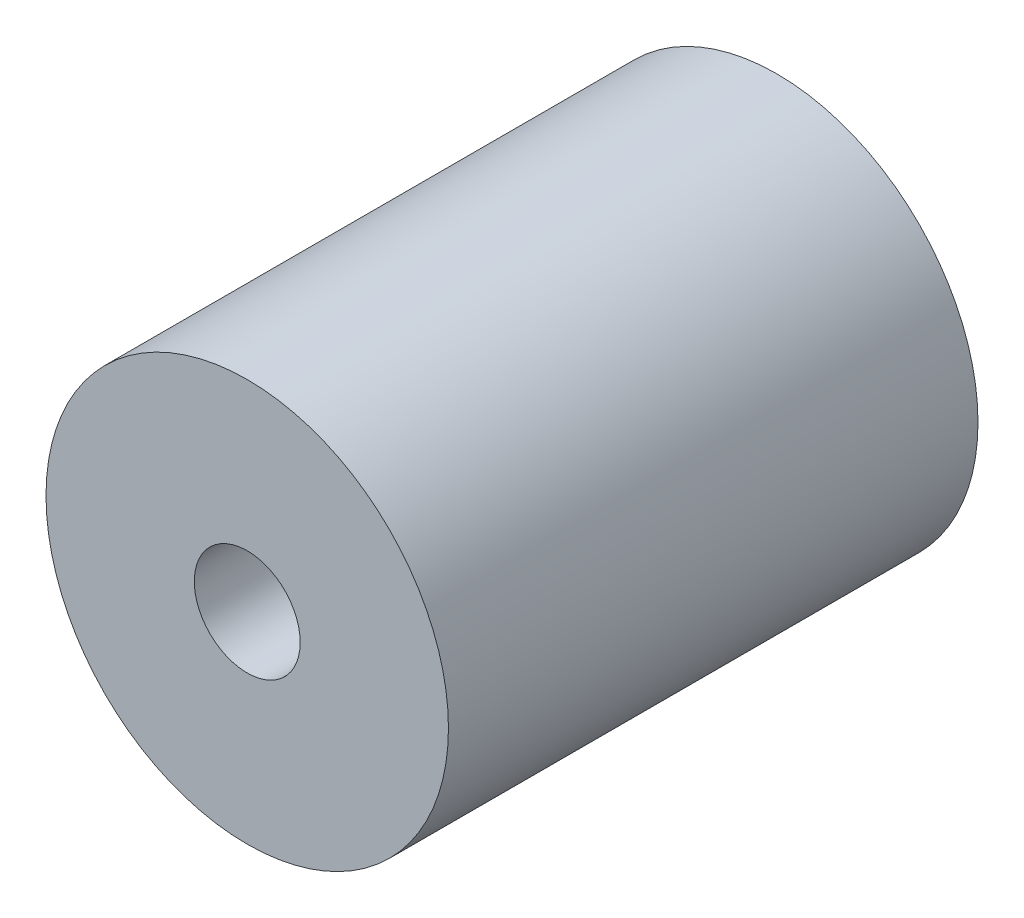
from build123d import *

# Parameters (mm, degrees)
SKETCH_1_R          = 9.5
EXTRUDE_1_DEPTH     = 25
SKETCH_2_R          = 4
CUT_EXTRUDE_1_DEPTH = 17.5
SKETCH_3_R          = 2.5
CUT_EXTRUDE_2_DEPTH = 7.5


with BuildPart() as part:
    # 草图1 → 凸台-拉伸1 (new body)
    with BuildSketch(Plane.XY):
        Circle(SKETCH_1_R)
    extrude(amount=EXTRUDE_1_DEPTH)

    # 草图2 → 切除-拉伸1 (cut)
    with BuildSketch(Plane(origin=(0, 0, 0), x_dir=(-1, 0, 0), z_dir=(0, 0, -1))):
        Circle(SKETCH_2_R)
    extrude(amount=-CUT_EXTRUDE_1_DEPTH, mode=Mode.SUBTRACT)

    # 草图3 → 切除-拉伸2 (cut)
    with BuildSketch(Plane.XY.offset(25)):
        Circle(SKETCH_3_R)
    extrude(amount=-CUT_EXTRUDE_2_DEPTH, mode=Mode.SUBTRACT)


solid = part.part
